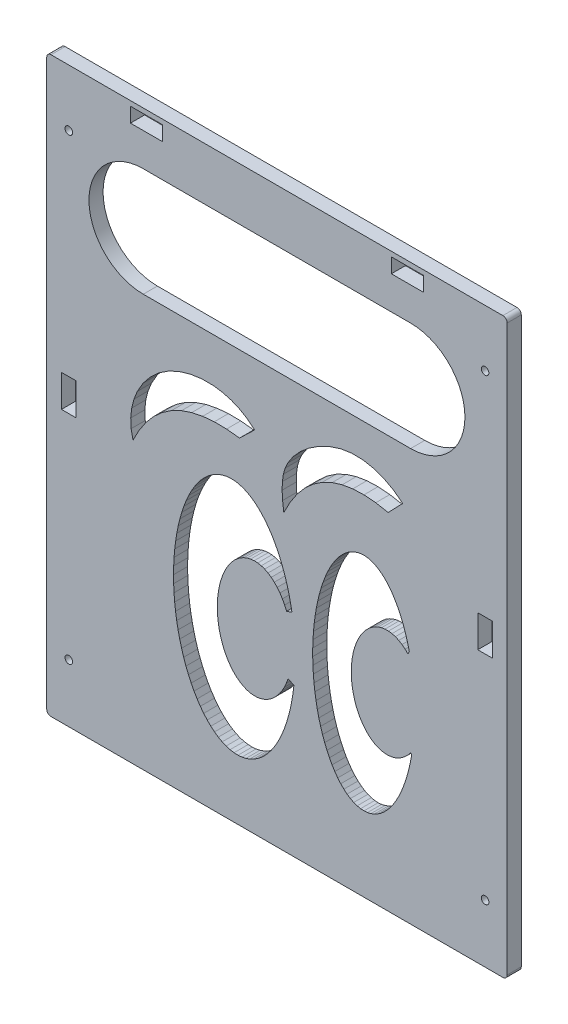
from build123d import *

# Parameters (mm, degrees)
MODEL_R             = 1.775
MODEL_W             = 15
MODEL_H             = 6.86
MODEL_W_2           = 6.86
MODEL_H_2           = 15
BOSS_EXTRUDE1_DEPTH = 6.6


with BuildPart() as part:
    # Model → Boss-Extrude1 (new body)
    with BuildSketch(Plane.XY):
        with BuildLine():
            Line((0, 266), (0, 2))
            ThreePointArc((0, 2), (0.585786438, 0.585786438), (2, 0))
            Line((2, 0), (213.28, 0))
            ThreePointArc((213.28, 0), (214.694213562, 0.585786438), (215.28, 2))
            Line((215.28, 2), (215.28, 266))
            ThreePointArc((215.28, 266), (214.694213562, 267.414213562), (213.28, 268))
            Line((213.28, 268), (2, 268))
            ThreePointArc((2, 268), (0.585786438, 267.414213562), (0, 266))
        make_face()
        with Locations((10.31, 241.465)):
            Circle(MODEL_R, mode=Mode.SUBTRACT)
        with Locations((204.97, 241.465)):
            Circle(MODEL_R, mode=Mode.SUBTRACT)
        with Locations((10.31, 27.175)):
            Circle(MODEL_R, mode=Mode.SUBTRACT)
        with Locations((204.97, 27.175)):
            Circle(MODEL_R, mode=Mode.SUBTRACT)
        Polygon((166.452754669, 168.505123877), (162.320758105, 171.650845031), (157.78188774, 174.138163017), (152.926381904, 175.89821884), (147.844478926, 176.862153503), (142.626417136, 176.961108012), (137.364889333, 176.135233719), (132.184901541, 174.443303601), (127.234254675, 172.027770544), (122.661227496, 169.032841602), (118.614098767, 165.602723833), (115.241147252, 161.881624293), (112.687748395, 158.006621424), (111.475833832, 155.315253537), (110.643585484, 152.430482396), (110.177722621, 149.254553556), (110.064964514, 145.689712571), (110.292030432, 141.638204997), (110.845639647, 137.002276387), (113.794537497, 142.654142549), (117.074098562, 147.612329134), (120.684322841, 151.876836142), (124.625210334, 155.447663572), (128.896761041, 158.324811426), (133.498974963, 160.508279702), (138.141065744, 161.931624497), (143.077109373, 162.738302305), (148.307105852, 162.928313125), (153.83105518, 162.501656959), (159.648957357, 161.458333804), align=None, mode=Mode.SUBTRACT)
        Polygon((112.831913003, 70.681513107), (112.008138621, 68.466149773), (111.055118813, 66.380833888), (109.981220208, 64.443872589), (108.79587064, 62.672270601), (107.509476377, 61.081580944), (106.133330768, 59.685768397), (104.679515094, 58.497086899), (103.160792508, 57.525971971), (101.590495984, 56.780949101), (99.982411269, 56.268558898), (98.350655854, 55.993299672), (96.709555038, 55.957587944), (95.073516162, 56.16173723), (93.456902131, 56.603955289), (91.873905315, 57.280359856), (90.338422957, 58.185012727), (88.863935167, 59.309971889), (87.46338658, 60.645361246), (86.149072712, 62.179457316), (84.932532021, 63.898792162), (83.824444604, 65.788271617), (82.83453844, 67.831307807), (81.971503987, 70.009964768), (81.242917887, 72.305115915), (80.655176449, 74.69661195), (80.213439498, 77.163457758), (79.921585074, 79.683996722), (79.782175389, 82.236100847), (79.796434329, 84.797365029), (79.964236716, 87.345303745), (80.284109399, 89.857548458), (80.753244193, 92.312043988), (81.36752253, 94.687242145), (82.121551616, 96.962290892), (83.008711776, 99.117217413), (84.021214567, 101.133103452), (85.150171154, 102.9922514), (86.385670345, 104.678339664), (87.716865604, 106.176565953), (89.132070273, 107.473777232), (90.618860166, 108.558585188), (92.16418265, 109.421466215), (93.754471226, 110.054845017), (95.375764637, 110.453161118), (97.01382943, 110.61291767), (98.654284918, 110.53271216), (100.282729423, 110.213248718), (101.884866713, 109.657331936), (103.446631511, 108.869842247), (104.954312969, 107.857693082), (106.394675045, 106.629770168), (107.755072696, 105.196853532), (109.023562892, 103.57152285), (110.189009468, 101.768047018), (111.241180883, 99.802258881), (112.170840049, 97.691416233), (114.654853095, 98.56404487), (113.997999825, 101.996092547), (113.229011542, 105.348236518), (112.351171164, 108.606166022), (111.368226312, 111.755972511), (110.284373311, 114.78420903), (109.104239278, 117.677947622), (107.832862367, 120.424834523), (106.475670261, 123.013142894), (105.038456998, 125.431822893), (103.527358238, 127.670548845), (101.948825069, 129.719763321), (100.309596466, 131.570717944), (98.616670519, 133.215510736), (96.877274561, 134.647119852), (95.098834311, 135.859433554), (93.288942176, 136.847276311), (91.455324831, 137.606430887), (89.605810241, 138.133656347), (87.748294236, 138.426701892), (85.890706807, 138.484316471), (84.040978249, 138.306254121), (82.207005306, 137.893275013), (80.39661746, 137.247142212), (78.617543505, 136.370614147), (76.87737855, 135.267432836), (75.183551598, 133.942307912), (73.543293829, 132.400896515), (71.963607728, 130.649779139), (70.45123719, 128.696431547), (69.012638733, 126.549192845), (67.65395393, 124.21722989), (66.380983193, 121.710498152), (65.199161008, 119.03969921), (64.113532737, 116.216235072), (63.128733074, 113.252159492), (62.248966264, 110.160126515), (61.477988153, 106.953336453), (60.819090151, 103.645479532), (60.275085185, 100.250677446), (59.848295685, 96.78342307), (59.540543675, 93.258518588), (59.35314299, 89.6910123), (59.28689367, 86.096134378), (59.342078541, 82.489231848), (59.518462013, 78.885703072), (59.815291079, 75.300932007), (60.231298536, 71.750222531), (60.764708391, 68.24873311), (61.413243445, 64.811412081), (62.174135012, 61.452933839), (63.044134743, 58.187636186), (64.019528488, 55.029459126), (65.09615216, 51.991885349), (66.269409503, 49.087882674), (67.534291721, 46.329848684), (68.885398861, 43.729557806), (70.316962858, 41.298111037), (71.822872172, 39.045888556), (73.39669787, 36.98250541), (75.031721072, 35.116770462), (76.720961643, 33.456648793), (78.457207982, 32.009227687), (80.233047816, 30.780686385), (82.040899842, 29.776269696), (83.873046091, 29.000265614), (85.721664882, 28.455987006), (87.578864206, 28.145757473), (89.436715426, 28.070901425), (91.28728712, 28.231738435), (93.122678945, 28.627581866), (94.935055361, 29.25674181), (96.716679086, 30.116532296), (98.459944123, 31.203282761), (100.157408236, 32.512353717), (101.801824718, 34.038156564), (103.38617333, 35.774177438), (104.90369027, 37.713005028), (106.347897052, 39.846362216), (107.712628158, 42.165141406), (108.992057364, 44.659443413), (110.180722613, 47.31861972), (111.273549329, 50.131317939), (112.265872085, 53.085530277), (113.15345452, 56.168644796), (113.932507423, 59.367499258), (114.599704911, 62.668437316), (115.152198625, 66.057366813), (115.587629895, 69.519819945), align=None, mode=Mode.SUBTRACT)
        Polygon((97.199817749, 163.645268654), (93.813848185, 166.421251913), (90.120402007, 168.631338264), (86.181884012, 170.28773512), (82.060698996, 171.402649895), (77.819251755, 171.988290003), (72.443393757, 171.994644866), (67.099017892, 171.216924748), (61.908008529, 169.678972253), (56.992250034, 167.404629986), (52.473625622, 164.417743971), (48.467718755, 160.760848985), (45.069062773, 156.538926808), (42.367799548, 151.869986887), (40.76948709, 147.892284521), (39.721349433, 143.764437679), (39.269539214, 139.546867199), (39.460209073, 135.299993915), (40.339511647, 131.084238664), (43.206016409, 136.538185349), (46.439559322, 141.364203561), (50.040140386, 145.562293298), (54.007759601, 149.132454562), (58.342416968, 152.074687351), (63.044112486, 154.388991667), (67.813316672, 155.995918799), (72.908810285, 157.044630333), (78.330593323, 157.535126268), (84.078665787, 157.467406605), (90.153027677, 156.841471343), align=None, mode=Mode.SUBTRACT)
        Polygon((169.556013432, 110.101423498), (168.780667788, 113.159984819), (167.91195778, 116.098388793), (166.953832746, 118.903276819), (165.910648524, 121.561897286), (164.78714765, 124.062163545), (163.588437794, 126.392708859), (162.319968545, 128.54293808), (160.987506629, 130.503075814), (159.5971097, 132.26421086), (158.155098794, 133.81833673), (156.668029597, 135.158388039), (155.142662637, 136.278272633), (153.585932554, 137.17289928), (152.00491657, 137.83820082), (150.406802317, 138.271152651), (148.798855159, 138.469786485), (147.188385161, 138.433199289), (145.582713858, 138.161557396), (143.989140972, 137.656095748), (142.414911218, 136.91911228), (140.867181377, 135.953957474), (139.352987755, 134.765019126), (137.879214193, 133.3577024), (136.452560778, 131.738405255), (135.079513375, 129.914489356), (133.766314147, 127.894246608), (132.518933173, 125.68686146), (131.343041311, 123.302369149), (130.243984412, 120.751610079), (129.22675902, 118.046180538), (128.295989656, 115.198379976), (127.455907792, 112.221155096), (126.710332618, 109.128040988), (126.062653676, 105.933099599), (125.51581545, 102.650855804), (125.072303982, 99.296231376), (124.734135568, 95.884477142), (124.502847594, 92.431103655), (124.379491542, 88.951810678), (124.364628216, 85.462415808), (124.458325187, 81.978782568), (124.660156489, 78.516748289), (124.969204554, 75.092052107), (125.384064386, 71.72026341), (125.902849944, 68.416711061), (126.523202719, 65.196413703), (127.242302458, 62.074011485), (128.056879981, 59.063699505), (128.963232048, 56.179163274), (129.957238192, 53.433516501), (131.034379451, 50.839241475), (132.189758915, 48.408132314), (133.418123986, 46.151241354), (134.713890258, 44.078828895), (136.071166904, 42.200316559), (137.483783459, 40.524244461), (138.945317871, 39.058232375), (140.449125698, 37.808945102), (141.988370312, 36.782062164), (143.556053983, 35.982251986), (145.145049692, 35.413150676), (146.74813353, 35.077345485), (148.358017541, 34.976363057), (149.967382852, 35.110662478), (151.568912952, 35.479633194), (153.155326946, 36.081597788), (154.719412663, 36.913819601), (156.25405944, 37.972515178), (157.752290451, 39.252871467), (159.207294421, 40.749067697), (160.612456597, 42.454301847), (161.961388816, 44.360821562), (163.247958548, 46.459959404), (164.466316775, 48.742172249), (165.610924587, 51.197084679), (166.676578353, 53.813536144), (167.658433389, 56.579631707), (168.552025975, 59.482796113), (169.35329365, 62.509830968), (170.058593683, 65.646974733), (170.664719633, 68.879965294), (170.142348655, 69.355402236), (168.865395592, 67.828075782), (167.495895647, 66.495481688), (166.046861621, 65.370282086), (164.532062044, 64.46316847), (162.965890336, 63.782760112), (161.363228051, 63.335522162), (159.739303471, 63.125704214), (158.109546908, 63.155299929), (156.48944409, 63.424028094), (154.894389018, 63.92933529), (153.33953769, 64.666420155), (151.839664094, 65.628279009), (150.409019828, 66.805772396), (149.061198681, 68.187711935), (147.809007469, 69.760966619), (146.664344345, 71.510587596), (145.638085744, 73.419950202), (144.739983037, 75.470911929), (143.978569875, 77.643984814), (143.361081104, 79.918520612), (142.89338402, 82.272906988), (142.579922617, 84.68477288), (142.423675363, 87.131201062), (142.426126899, 89.588945901), (142.587253931, 92.034654237), (142.905525451, 94.445087278), (143.377917286, 96.797341412), (143.999940832, 99.069065837), (144.765685706, 101.238674932), (145.667875901, 103.285553364), (146.697938929, 105.190251968), (147.846087268, 106.934672554), (149.101411368, 108.502239872), (150.451983307, 109.878059109), (151.884970132, 111.049057414), (153.386755795, 112.004108118), (154.94307053, 112.73413646), (156.539126444, 113.232205806), (158.159758028, 113.49358357), (159.789566259, 113.515786174), (161.413064916, 113.298602653), (163.014827736, 112.844096655), (164.579634981, 112.156586836), (166.092618064, 111.24260582), (167.539400823, 110.110838134), (168.906236123, 108.772037681), align=None, mode=Mode.SUBTRACT)
        with Locations((46.64, 262.3)):
            Rectangle(MODEL_W, MODEL_H, mode=Mode.SUBTRACT)
        with Locations((168.64, 262.3)):
            Rectangle(MODEL_W, MODEL_H, mode=Mode.SUBTRACT)
        with Locations((10.31, 134.32)):
            Rectangle(MODEL_W_2, MODEL_H_2, mode=Mode.SUBTRACT)
        with Locations((204.97, 134.32)):
            Rectangle(MODEL_W_2, MODEL_H_2, mode=Mode.SUBTRACT)
        with BuildLine():
            Line((45.14, 192.6), (170.14, 192.6))
            ThreePointArc((170.14, 192.6), (195.54, 218), (170.14, 243.4))
            Line((170.14, 243.4), (45.14, 243.4))
            ThreePointArc((45.14, 243.4), (19.74, 218), (45.14, 192.6))
        make_face(mode=Mode.SUBTRACT)
    extrude(amount=BOSS_EXTRUDE1_DEPTH)


solid = part.part
